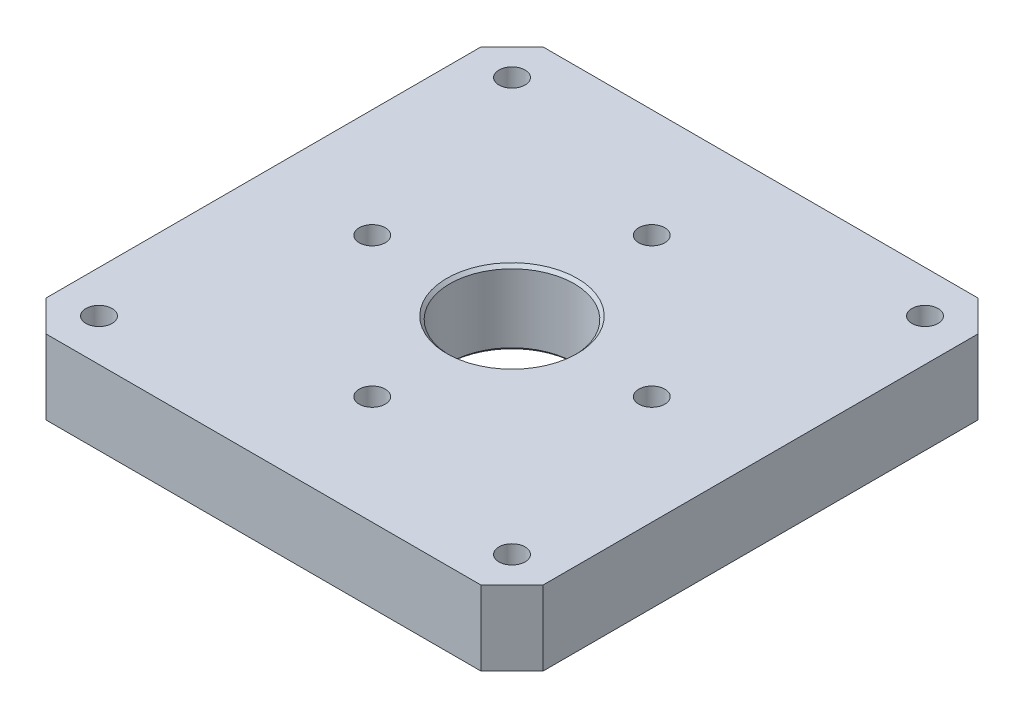
from build123d import *

# Parameters (mm, degrees)
EXTRUDE_1_DEPTH     = 12
HOLE_WIZARD_M5_1_D  = 4.2
SKETCH_5_R          = 10
CUT_EXTRUDE_1_DEPTH = 114.771701227
CHAMFER_1_SIZE      = 0.5


with BuildPart() as part:
    # 스케치1 → 보스-돌출1 (new body)
    with BuildSketch(Plane(origin=(0, 0, 0), x_dir=(1, 0, 0), z_dir=(0, 1, 0))):
        Polygon((0, 75), (5, 80), (75, 80), (80, 75), (80, 5), (75, 0), (5, 0), (0, 5), align=None)
    extrude(amount=EXTRUDE_1_DEPTH)

    # M5 나사 구멍1 (through all)
    with Locations(Plane(origin=(0, 12, 0), x_dir=(1, 0, 0), z_dir=(0, 1, 0))):
        with Locations((6.765981284, 73.234018716), (40, 62.5), (73.234018716, 73.234018716), (62.5, 40), (40, 17.5), (17.5, 40), (6.765981284, 6.765981284), (73.234018716, 6.765981284)):
            Hole(HOLE_WIZARD_M5_1_D / 2)

    # 스케치5 → 컷-돌출1 (cut, through all)
    with BuildSketch(Plane(origin=(0, 12, 0), x_dir=(1, 0, 0), z_dir=(0, 1, 0))):
        with Locations(Location((40, 40, 0), (0, 0, 270))):
            Circle(SKETCH_5_R)
    extrude(amount=-CUT_EXTRUDE_1_DEPTH, mode=Mode.SUBTRACT)

    # 모따기1
    chamfer_1_edges = [part.edges().sort_by_distance(p)[0] for p in [
        (40, 0, -50),
        (40, 12, -50),
    ]]
    chamfer(chamfer_1_edges, length=CHAMFER_1_SIZE)


solid = part.part
